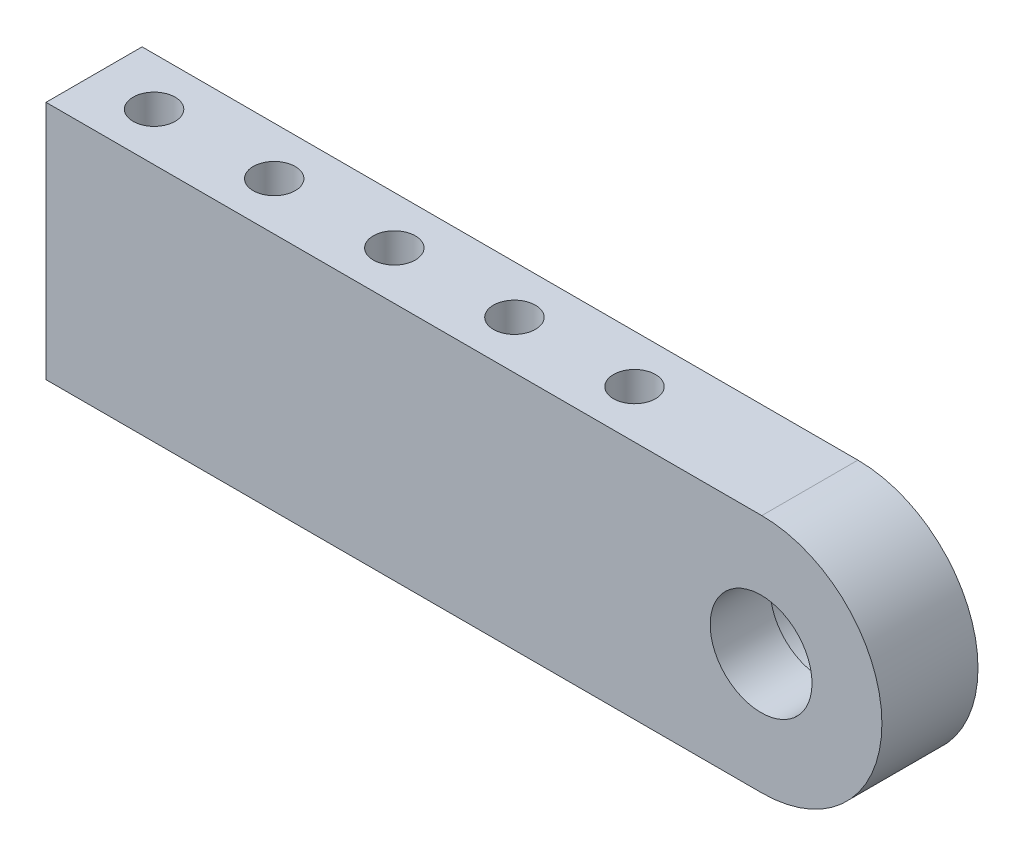
from build123d import *

# Parameters (mm, degrees)
ESQUISSE1_R             = 5.3
BOSS_EXTRU_1_DEPTH      = 3
ESQUISSE2_R             = 4.239698474
BOSS_EXTRU_2_DEPTH      = 5
ESQUISSE3_R             = 1.75
ENL_V_MAT_EXTRU_1_DEPTH = 64.373180447


with BuildPart() as part:
    # Esquisse1 → Boss.-Extru.1 (new body)
    with BuildSketch(Plane.XY):
        with BuildLine():
            Line((0, 10), (-59.6, 10))
            Line((-59.6, 10), (-59.6, -10))
            Line((-59.6, -10), (0, -10))
            ThreePointArc((0, -10), (10, 0), (0, 10))
        make_face()
        Circle(ESQUISSE1_R, mode=Mode.SUBTRACT)
    extrude(amount=BOSS_EXTRU_1_DEPTH)

    # Esquisse2 → Boss.-Extru.2 (add)
    with BuildSketch(Plane.XY.offset(3)):
        with BuildLine():
            Line((-59.6, 10), (-59.6, -10))
            Line((-59.6, -10), (0, -10))
            ThreePointArc((0, -10), (10, 0), (0, 10))
            Line((0, 10), (-59.6, 10))
        make_face()
        with Locations((-0.060301526, 0)):
            Circle(ESQUISSE2_R, mode=Mode.SUBTRACT)
    extrude(amount=BOSS_EXTRU_2_DEPTH)

    # Esquisse3 → Enlèv. mat.-Extru.1 (cut, through all)
    with BuildSketch(Plane(origin=(0, 10, 0), x_dir=(1, 0, 0), z_dir=(0, 1, 0))):
        with Locations(Location((-54.6, -4, 0), (0, 0, 180))):
            Circle(ESQUISSE3_R)
        with Locations(Location((-44.6, -4, 0), (0, 0, 180))):
            Circle(ESQUISSE3_R)
        with Locations(Location((-34.6, -4, 0), (0, 0, 180))):
            Circle(ESQUISSE3_R)
        with Locations(Location((-24.6, -4, 0), (0, 0, 180))):
            Circle(ESQUISSE3_R)
        with Locations(Location((-14.6, -4, 0), (0, 0, 180))):
            Circle(ESQUISSE3_R)
    extrude(amount=-ENL_V_MAT_EXTRU_1_DEPTH, mode=Mode.SUBTRACT)


solid = part.part
